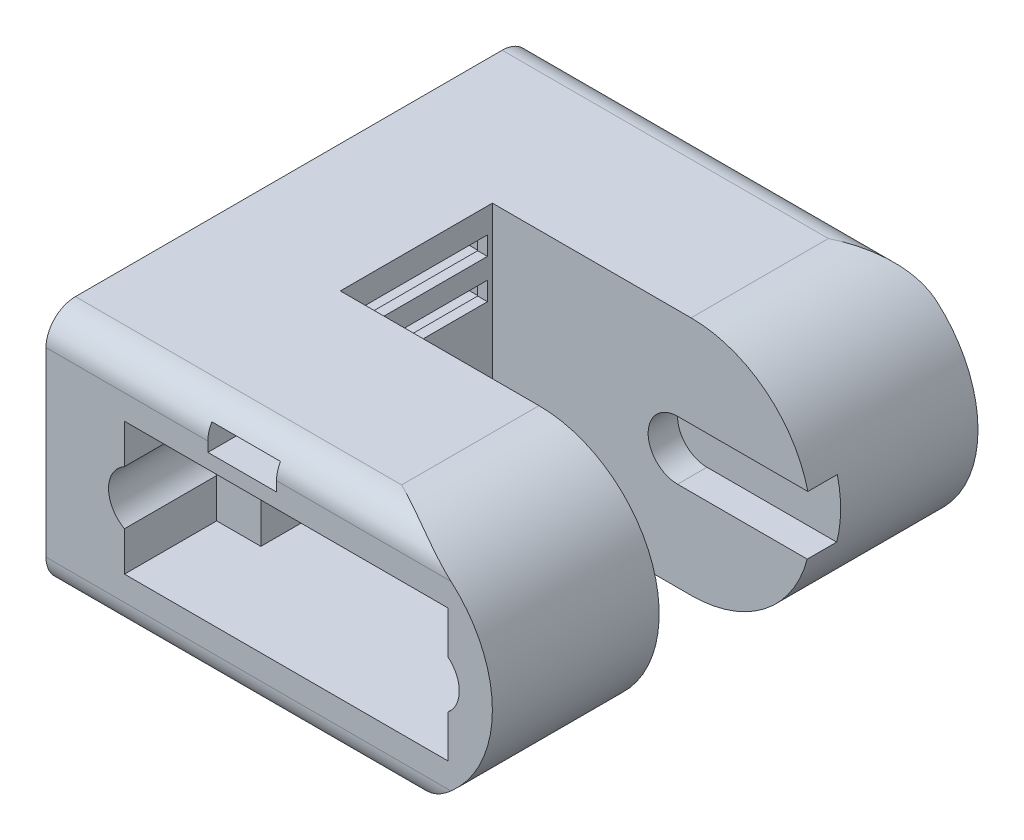
from build123d import *

# Parameters (mm, degrees)
SKETCH_1_W           = 49.5
SKETCH_1_H           = 24.5
EXTRUDE_1_DEPTH      = 36
SKETCH_2_R           = 2.5
CUT_EXTRUDE_1_DEPTH  = 3
SKETCH_3_W           = 15.4
SKETCH_3_H           = 2.7
CUT_EXTRUDE_2_DEPTH  = 12
SKETCH_9_W           = 23
SKETCH_9_H           = 49.5
CUT_EXTRUDE_9_DEPTH  = 24.5
SKETCH_11_W          = 14.5
SKETCH_11_H          = 1.9
CUT_EXTRUDE_8_DEPTH  = 2
FILLET_1_R           = 3
EXTRUDE_START        = 32.5
EXTRUDE_2_DEPTH      = 32.5
SKETCH_13_W          = 23.5
SKETCH_13_H          = 13.5
CUT_EXTRUDE_10_DEPTH = 7.6
SKETCH_14_W          = 33
SKETCH_14_H          = 13.5
CUT_EXTRUDE_11_DEPTH = 9.4
SKETCH_16_R          = 1.45
CUT_EXTRUDE_12_DEPTH = 17
SKETCH_17_R          = 3.125
CUT_EXTRUDE_13_DEPTH = 9.4
CUT_EXTRUDE_14_DEPTH = 3
CUT_EXTRUDE_START    = -49.5
CUT_EXTRUDE_15_DEPTH = 49.5
SKETCH_20_W          = 7
SKETCH_20_H          = 2.5
CUT_EXTRUDE_16_DEPTH = 19


with BuildPart() as part:
    # Эскиз1 → Бобышка-Вытянуть1 (new body)
    with BuildSketch(Plane(origin=(0, 0, 0), x_dir=(0, 0, -1), z_dir=(1, 0, 0))):
        Rectangle(SKETCH_1_W, SKETCH_1_H)
    extrude(amount=EXTRUDE_1_DEPTH)

    # Эскиз2 → Вырез-Вытянуть1 (cut)
    with BuildSketch(Plane.ZY):
        with Locations((-20, -7.25)):
            Circle(SKETCH_2_R)
        with Locations((20, -7.25)):
            Circle(SKETCH_2_R)
    extrude(amount=-CUT_EXTRUDE_1_DEPTH, mode=Mode.SUBTRACT)

    # Эскиз3 → Вырез-Вытянуть2 (cut)
    with BuildSketch(Plane.ZY):
        with Locations((0, 4.75)):
            Rectangle(SKETCH_3_W, SKETCH_3_H)
        with Locations((0, 8.75)):
            Rectangle(SKETCH_3_W, SKETCH_3_H)
    extrude(amount=-CUT_EXTRUDE_2_DEPTH, mode=Mode.SUBTRACT)

    # Эскиз9 → Вырез-Вытянуть9 (cut)
    with BuildSketch(Plane.XZ.offset(-12.25)):
        with Locations((24.5, 0)):
            Rectangle(SKETCH_9_W, SKETCH_9_H)
    extrude(amount=CUT_EXTRUDE_9_DEPTH, mode=Mode.SUBTRACT)

    # Эскиз11 → Вырез-Вытянуть8 (cut)
    with BuildSketch(Plane.ZY.offset(-12)):
        with Locations((0, 8.75)):
            Rectangle(SKETCH_11_W, SKETCH_11_H)
        with Locations((0, 4.75)):
            Rectangle(SKETCH_11_W, SKETCH_11_H)
    extrude(amount=-CUT_EXTRUDE_8_DEPTH, mode=Mode.SUBTRACT)

    # Скругление1
    fillet_1_edges = [part.edges().sort_by_distance(p)[0] for p in [
        (6.5, 12.25, -24.75),
        (6.5, -12.25, -24.75),
        (6.5, -12.25, 24.75),
        (6.5, 12.25, 24.75),
    ]]
    fillet(fillet_1_edges, radius=FILLET_1_R)

    # Эскиз12 → Бобышка-Вытянуть2 (add)
    with BuildSketch(Plane(origin=(13, 0, 0), x_dir=(0, 0, -1), z_dir=(1, 0, 0)).offset(EXTRUDE_START)):
        with BuildLine():
            Line((-7.75, 12.25), (-7.75, -12.25))
            Line((-7.75, -12.25), (-21.75, -12.25))
            ThreePointArc((-21.75, -12.25), (-23.871320344, -11.371320344), (-24.75, -9.25))
            Line((-24.75, -9.25), (-24.75, 9.25))
            ThreePointArc((-24.75, 9.25), (-23.871320344, 11.371320344), (-21.75, 12.25))
            Line((-21.75, 12.25), (-7.75, 12.25))
        make_face()
        with BuildLine():
            Line((21.75, 12.25), (7.75, 12.25))
            Line((7.75, 12.25), (7.75, -12.25))
            Line((7.75, -12.25), (21.75, -12.25))
            ThreePointArc((21.75, -12.25), (23.871320344, -11.371320344), (24.75, -9.25))
            Line((24.75, -9.25), (24.75, 9.25))
            ThreePointArc((24.75, 9.25), (23.871320344, 11.371320344), (21.75, 12.25))
        make_face()
    extrude(amount=-EXTRUDE_2_DEPTH)

    # Эскиз13 → Вырез-Вытянуть10 (cut)
    with BuildSketch(Plane(origin=(0, 0, 7.75), x_dir=(-1, 0, 0), z_dir=(0, 0, -1))):
        with Locations((-24.25, 0)):
            Rectangle(SKETCH_13_W, SKETCH_13_H)
    extrude(amount=-CUT_EXTRUDE_10_DEPTH, mode=Mode.SUBTRACT)

    # Эскиз14 → Вырез-Вытянуть11 (cut)
    with BuildSketch(Plane(origin=(0, 0, 15.35), x_dir=(-1, 0, 0), z_dir=(0, 0, -1))):
        with Locations((-24.5, 0)):
            Rectangle(SKETCH_14_W, SKETCH_14_H)
    extrude(amount=-CUT_EXTRUDE_11_DEPTH, mode=Mode.SUBTRACT)

    # Эскиз16 → Вырез-Вытянуть12 (cut)
    with BuildSketch(Plane.XY.offset(24.75)):
        with Locations((9.5, 0)):
            Circle(SKETCH_16_R)
        with Locations((39, 0)):
            Circle(SKETCH_16_R)
    extrude(amount=-CUT_EXTRUDE_12_DEPTH, mode=Mode.SUBTRACT)

    # Эскиз17 → Вырез-Вытянуть13 (cut)
    with BuildSketch(Plane.XY.offset(24.75)):
        with Locations((9.5, 0)):
            Circle(SKETCH_17_R)
        with Locations((39, 0)):
            Circle(SKETCH_17_R)
    extrude(amount=-CUT_EXTRUDE_13_DEPTH, mode=Mode.SUBTRACT)

    # Эскиз18 → Вырез-Вытянуть14 (cut)
    with BuildSketch(Plane.XY.offset(-7.75)):
        with BuildLine():
            Line((31.875, 2.875), (45.5, 2.875))
            Line((45.5, 2.875), (45.5, -3.125))
            Line((45.5, -3.125), (31.875, -3.125))
            ThreePointArc((31.875, -3.125), (28.875, -0.125), (31.875, 2.875))
        make_face()
    extrude(amount=-CUT_EXTRUDE_14_DEPTH, mode=Mode.SUBTRACT)

    # Эскиз19 → Вырез-Вытянуть15 (cut)
    with BuildSketch(Plane(origin=(0, 0, -24.75), x_dir=(-1, 0, 0), z_dir=(0, 0, -1)).offset(CUT_EXTRUDE_START)):
        with BuildLine():
            Line((-33.25, 12.25), (-46.5, 12.25))
            Line((-46.5, 12.25), (-46.5, -12.25))
            Line((-46.5, -12.25), (-33.25, -12.25))
            ThreePointArc((-33.25, -12.25), (-45.5, 0), (-33.25, 12.25))
        make_face()
    extrude(amount=CUT_EXTRUDE_15_DEPTH, mode=Mode.SUBTRACT)

    # Эскиз20 → Вырез-Вытянуть16 (cut)
    with BuildSketch(Plane.XY.offset(24.75)):
        with Locations((20, 9.5)):
            Rectangle(SKETCH_20_W, SKETCH_20_H)
    extrude(amount=-CUT_EXTRUDE_16_DEPTH, mode=Mode.SUBTRACT)


solid = part.part
